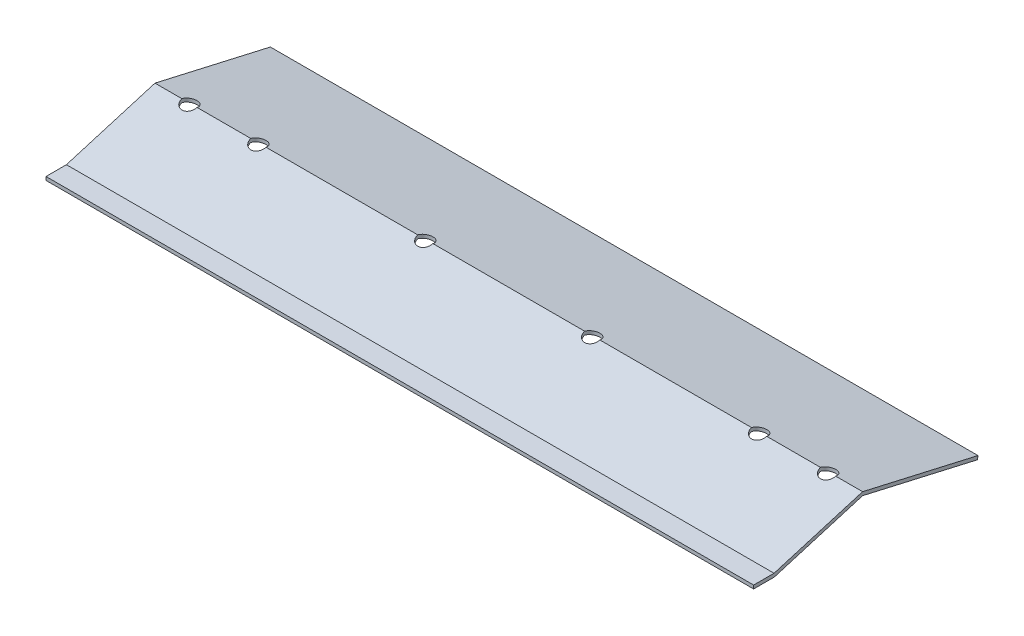
from build123d import *

# Parameters (mm, degrees)
BOSS_EXTRUDE1_DEPTH     = 1026
CUT_EXTRUDE1_DEPTH      = 30126.076908122
CUT_EXTRUDE1_DEPTH_BACK = 30126.076908122
SKETCH2_R               = 11


with BuildPart() as part:
    # Sketch1 → Boss-Extrude1 (new body)
    with BuildSketch(Plane(origin=(0, 0, 0), x_dir=(0, 0, -1), z_dir=(1, 0, 0))):
        Polygon((-29120.788440545, 7606.867460507), (-29091.195271738, 7606.867460507), (-28962.788440545, 7645.080988537), (-28795.480129553, 7606.801691282), (-28796.288440545, 7601.867460507), (-28962.788440545, 7640.014342662), (-29090.788440545, 7601.867460507), (-29120.788440545, 7601.867460507), align=None)
    extrude(amount=BOSS_EXTRUDE1_DEPTH)

    # Sketch2 → Cut-Extrude1 (cut, two sides: drawn at the far end of the back side and taken through both)
    with BuildSketch(Plane(origin=(0, 0, 0), x_dir=(1, 0, 0), z_dir=(0, 1, 0)).offset(-CUT_EXTRUDE1_DEPTH_BACK)):
        with Locations(Location((50, -28962.788440545, 0), (0, 0, 180))):
            Circle(SKETCH2_R)
        with Locations(Location((150, -28962.788440545, 0), (0, 0, 180))):
            Circle(SKETCH2_R)
        with Locations(Location((392, -28962.788440545, 0), (0, 0, 180))):
            Circle(SKETCH2_R)
        with Locations(Location((634, -28962.788440545, 0), (0, 0, 180))):
            Circle(SKETCH2_R)
        with Locations(Location((876, -28962.788440545, 0), (0, 0, 180))):
            Circle(SKETCH2_R)
        with Locations(Location((976, -28962.788440545, 0), (0, 0, 180))):
            Circle(SKETCH2_R)
    extrude(amount=CUT_EXTRUDE1_DEPTH + CUT_EXTRUDE1_DEPTH_BACK, mode=Mode.SUBTRACT)


solid = part.part
